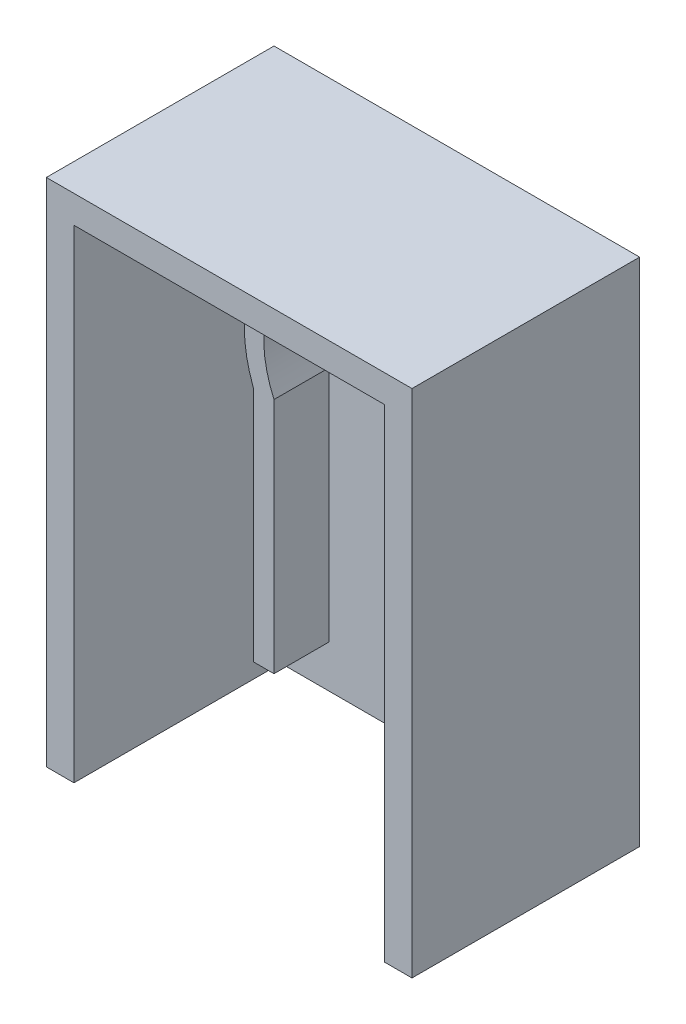
from build123d import *

# Parameters (mm, degrees)
BOSS_EXTRUDE1_DEPTH = 4
SKETCH3_W           = 22.5
SKETCH3_H           = 35
BOSS_EXTRUDE2_DEPTH = 1.5
BOSS_EXTRUDE5_DEPTH = 15
BOSS_EXTRUDE6_DEPTH = 1.5


with BuildPart() as part:
    # Sketch1 → Boss-Extrude1 (new body)
    with BuildSketch(Plane.XY):
        with BuildLine():
            Line((-7.75, -19.202403031), (-7.75, -3.491060011))
            ThreePointArc((-7.75, -3.491060011), (0, 8.5), (7.75, -3.491060011))
            Line((7.75, -3.491060011), (7.75, -19.202403031))
            Line((7.75, -19.202403031), (7.75, -20.702403031))
            Line((7.75, -20.702403031), (9.25, -20.702403031))
            Line((9.25, -20.702403031), (9.25, -3.491060011))
            ThreePointArc((9.25, -3.491060011), (0, 9.961709327), (-9.25, -3.491060011))
            Line((-9.25, -3.491060011), (-9.25, -20.702403031))
            Line((-9.25, -20.702403031), (-7.75, -20.702403031))
            Line((-7.75, -20.702403031), (-7.75, -19.202403031))
        make_face()
    extrude(amount=BOSS_EXTRUDE1_DEPTH)

    # Sketch3 → Boss-Extrude2 (add)
    with BuildSketch(Plane.XY):
        with Locations((0, -6.3)):
            Rectangle(SKETCH3_W, SKETCH3_H)
    extrude(amount=-BOSS_EXTRUDE2_DEPTH)



with BuildPart() as body_2:
    # Sketch9 → Boss-Extrude5 (new body)
    with BuildSketch(Plane.XY):
        Polygon((-13.25, 13.2), (13.25, 13.2), (13.25, -23.8), (11.25, -23.8), (11.25, 11.2), (-11.25, 11.2), (-11.25, -23.8), (-13.25, -23.8), align=None)
    extrude(amount=BOSS_EXTRUDE5_DEPTH)


with BuildPart() as part_1:
    add(part.part)

    add(body_2.part)  # Boss-Extrude6 merges body 2
    # Sketch10 → Boss-Extrude6 (add)
    with BuildSketch(Plane.XY):
        Polygon((-13.25, 13.2), (13.25, 13.2), (13.25, -23.8), (11.25, -23.8), (11.25, 11.2), (-11.25, 11.2), (-11.25, -23.8), (-13.25, -23.8), align=None)
    extrude(amount=-BOSS_EXTRUDE6_DEPTH)


solid = part_1.part
